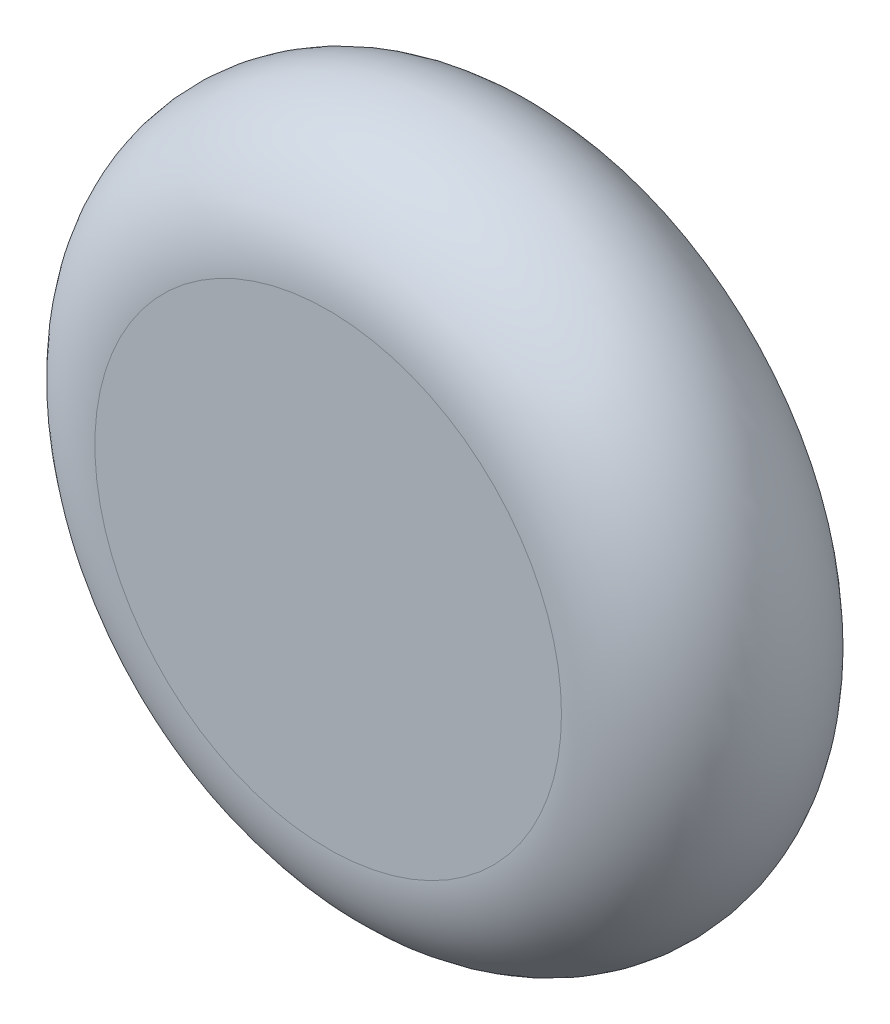
from build123d import *

# Parameters (mm, degrees)
SKETCH3_R           = 7.5
BOSS_EXTRUDE1_DEPTH = 20


with BuildPart() as part:
    # Sketch2 → Revolve1 (revolve)
    with BuildSketch(Plane(origin=(0, 0, 0), x_dir=(0, 0, -1), z_dir=(1, 0, 0)), mode=Mode.PRIVATE) as revolve1_sk:
        with BuildLine():
            ThreePointArc((-45, 90), (-31.819805153, 58.180194847), (0, 45))
            Line((0, 45), (0, 135))
            ThreePointArc((0, 135), (-31.819805153, 121.819805153), (-45, 90))
        make_face()
        with BuildLine():
            Line((-45, 0), (0, 0))
            Line((0, 0), (0, 45))
            ThreePointArc((0, 45), (-31.819805153, 58.180194847), (-45, 90))
            Line((-45, 90), (-45, 0))
        make_face()
        with BuildLine():
            Line((0, 45), (0, 0))
            Line((0, 0), (35, 0))
            Line((35, 0), (35, 61.715728753))
            ThreePointArc((35, 61.715728753), (19.393398282, 49.393398282), (0, 45))
        make_face()
        with BuildLine():
            Line((0, 135), (0, 45))
            ThreePointArc((0, 45), (19.393398282, 49.393398282), (35, 61.715728753))
            Line((35, 61.715728753), (35, 118.284271247))
            ThreePointArc((35, 118.284271247), (19.393398282, 130.606601718), (0, 135))
        make_face()
    revolve(revolve1_sk.sketch.rotate(Axis((0, 0, 45), (0, 0, -1)), 90), axis=Axis((0, 0, 45), (0, 0, -1)))

    # Sketch3 → Boss-Extrude1 (add)
    with BuildSketch(Plane(origin=(0, 0, -35), x_dir=(-1, 0, 0), z_dir=(0, 0, -1))):
        with Locations(Location((0, 0, 0), (0, 0, 180))):
            Circle(SKETCH3_R)
    extrude(amount=BOSS_EXTRUDE1_DEPTH)


solid = part.part
